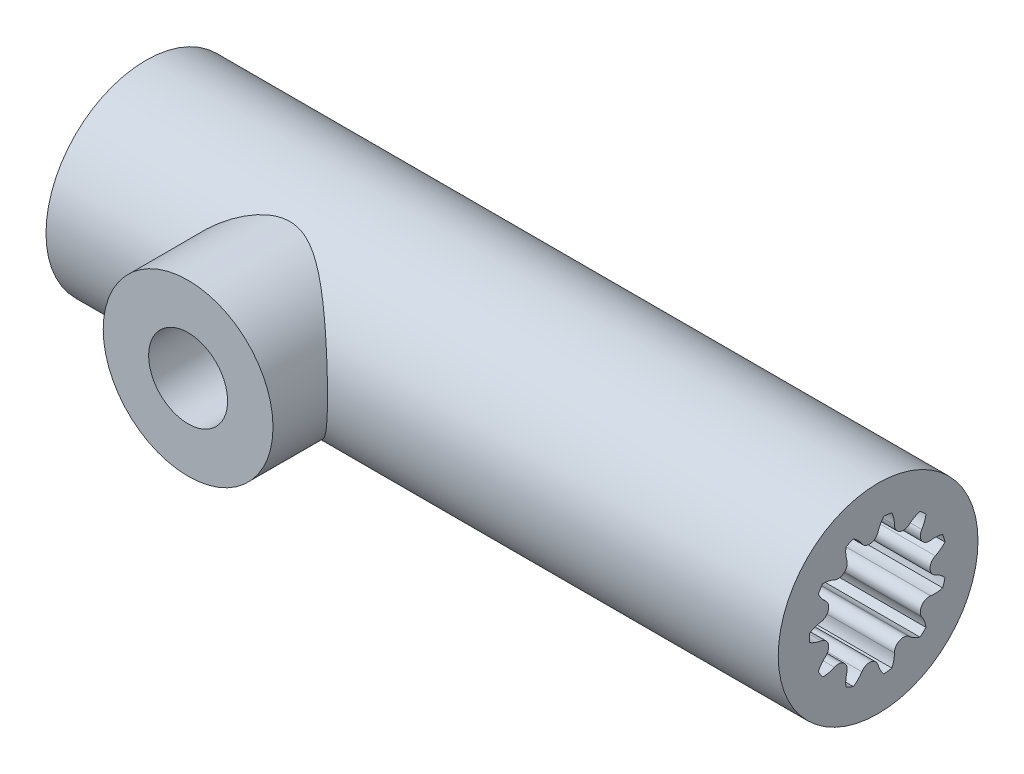
from build123d import *

# Parameters (mm, degrees)
SKETCH1_R           = 5.5
BOSS_EXTRUDE1_DEPTH = 14
SKETCH2_R           = 5.5
BOSS_EXTRUDE2_DEPTH = 13.52
SKETCH3_R           = 5.5
BOSS_EXTRUDE3_DEPTH = 12.8
SKETCH4_R           = 1.05
CUT_EXTRUDE1_DEPTH  = 3.5
SKETCH5_R           = 4.675
SKETCH5_R_2         = 2.175
BOSS_EXTRUDE4_DEPTH = 6
SKETCH5_2_R         = 2.175
CUT_EXTRUDE2_DEPTH  = 42.472308963


with BuildPart() as part:
    # Sketch1 → Boss-Extrude1 (new body)
    with BuildSketch(Plane.YZ):
        Circle(SKETCH1_R)
        with BuildLine():
            Line((-1.747140521, 2.5), (1.747140521, 2.5))
            ThreePointArc((1.747140521, 2.5), (0, -3.05), (-1.747140521, 2.5))
        make_face(mode=Mode.SUBTRACT)
    extrude(amount=BOSS_EXTRUDE1_DEPTH)

    # Sketch2 → Boss-Extrude2 (add)
    with BuildSketch(Plane.YZ.offset(14)):
        Circle(SKETCH2_R)
    extrude(amount=BOSS_EXTRUDE2_DEPTH)

    # Sketch3 → Boss-Extrude3 (add)
    with BuildSketch(Plane.YZ.offset(27.52)):
        Circle(SKETCH3_R)
        with BuildLine():
            ThreePointArc((-1.322019746, -2.893008891), (-1.318956528, -2.868853063), (-1.317084788, -2.844575833))
            ThreePointArc((-1.317084788, -2.844575833), (-1.543809469, -2.402214423), (-2.040380396, -2.37974197))
            ThreePointArc((-2.040380396, -2.37974197), (-2.061686193, -2.391529691), (-2.0823866, -2.404350785))
            ThreePointArc((-2.0823866, -2.404350785), (-2.380259348, -2.555545236), (-2.703854763, -2.638454478))
            ThreePointArc((-2.703854763, -2.638454478), (-2.855120731, -2.473976197), (-2.996397469, -2.300842198))
            ThreePointArc((-2.996397469, -2.300842198), (-2.868279694, -1.992339732), (-2.676232473, -1.719016114))
            ThreePointArc((-2.676232473, -1.719016114), (-2.660595904, -1.700351039), (-2.645896034, -1.680939672))
            ThreePointArc((-2.645896034, -1.680939672), (-2.597470339, -1.186224957), (-3.003062861, -0.898853414))
            ThreePointArc((-3.003062861, -0.898853414), (-3.02735936, -0.897251093), (-3.051705258, -0.896845399))
            ThreePointArc((-3.051705258, -0.896845399), (-3.384033651, -0.862996099), (-3.701083558, -0.757794901))
            ThreePointArc((-3.701083558, -0.757794901), (-3.739412915, -0.537646409), (-3.764659163, -0.315616851))
            ThreePointArc((-3.764659163, -0.315616851), (-3.490090608, -0.12535376), (-3.1807603, 0.000752133))
            ThreePointArc((-3.1807603, 0.000752133), (-3.157514879, 0.008000426), (-3.134653985, 0.016382957))
            ThreePointArc((-3.134653985, 0.016382957), (-2.82645273, 0.406382552), (-3.012294086, 0.86741475))
            ThreePointArc((-3.012294086, 0.86741475), (-3.031867321, 0.881898388), (-3.052129059, 0.895402065))
            ThreePointArc((-3.052129059, 0.895402065), (-3.31340118, 1.103548202), (-3.523244473, 1.363459202))
            ThreePointArc((-3.523244473, 1.363459202), (-3.43646792, 1.569382314), (-3.337668173, 1.769814617))
            ThreePointArc((-3.337668173, 1.769814617), (-3.003822413, 1.781431146), (-2.675419206, 1.720281583))
            ThreePointArc((-2.675419206, 1.720281583), (-2.65194519, 1.713811812), (-2.628181444, 1.708504114))
            ThreePointArc((-2.628181444, 1.708504114), (-2.158056349, 1.869966471), (-2.065143222, 2.35828486))
            ThreePointArc((-2.065143222, 2.35828486), (-2.07377883, 2.381051361), (-2.083523449, 2.4033657))
            ThreePointArc((-2.083523449, 2.4033657), (-2.190787246, 2.719723746), (-2.226800162, 3.051824643))
            ThreePointArc((-2.226800162, 3.051824643), (-2.042468641, 3.178143241), (-1.850991121, 3.293342448))
            ThreePointArc((-1.850991121, 3.293342448), (-1.563861826, 3.12262425), (-1.320651417, 2.893633786))
            ThreePointArc((-1.320651417, 2.893633786), (-1.304401641, 2.875500057), (-1.287279864, 2.858187286))
            ThreePointArc((-1.287279864, 2.858187286), (-0.804492326, 2.739849249), (-0.462323977, 3.100416189))
            ThreePointArc((-0.462323977, 3.100416189), (-0.457280213, 3.124237351), (-0.453413865, 3.148277707))
            ThreePointArc((-0.453413865, 3.148277707), (-0.372613841, 3.472406218), (-0.223362534, 3.771257322))
            ThreePointArc((-0.223362534, 3.771257322), (-0.111730141, 3.776213578), (0, 3.777866145))
            ThreePointArc((0, 3.777866145), (0.111730141, 3.776213578), (0.223362534, 3.771257322))
            ThreePointArc((0.223362534, 3.771257322), (0.372613841, 3.472406218), (0.453413865, 3.148277707))
            ThreePointArc((0.453413865, 3.148277707), (0.457280213, 3.124237351), (0.462323977, 3.100416189))
            ThreePointArc((0.462323977, 3.100416189), (0.804492326, 2.739849249), (1.287279864, 2.858187286))
            ThreePointArc((1.287279864, 2.858187286), (1.304401641, 2.875500057), (1.320651417, 2.893633786))
            ThreePointArc((1.320651417, 2.893633786), (1.563861826, 3.12262425), (1.850991121, 3.293342448))
            ThreePointArc((1.850991121, 3.293342448), (2.042468641, 3.178143241), (2.226800162, 3.051824643))
            ThreePointArc((2.226800162, 3.051824643), (2.190787246, 2.719723746), (2.083523449, 2.4033657))
            ThreePointArc((2.083523449, 2.4033657), (2.07377883, 2.381051361), (2.065143222, 2.35828486))
            ThreePointArc((2.065143222, 2.35828486), (2.158056349, 1.869966471), (2.628181444, 1.708504114))
            ThreePointArc((2.628181444, 1.708504114), (2.65194519, 1.713811812), (2.675419206, 1.720281583))
            ThreePointArc((2.675419206, 1.720281583), (3.003822413, 1.781431146), (3.337668173, 1.769814617))
            ThreePointArc((3.337668173, 1.769814617), (3.43646792, 1.569382314), (3.523244473, 1.363459202))
            ThreePointArc((3.523244473, 1.363459202), (3.31340118, 1.103548202), (3.052129059, 0.895402065))
            ThreePointArc((3.052129059, 0.895402065), (3.031867321, 0.881898388), (3.012294086, 0.86741475))
            ThreePointArc((3.012294086, 0.86741475), (2.82645273, 0.406382552), (3.134653985, 0.016382957))
            ThreePointArc((3.134653985, 0.016382957), (3.157514879, 0.008000426), (3.1807603, 0.000752133))
            ThreePointArc((3.1807603, 0.000752133), (3.490090608, -0.12535376), (3.764659163, -0.315616851))
            ThreePointArc((3.764659163, -0.315616851), (3.739412915, -0.537646409), (3.701083558, -0.757794901))
            ThreePointArc((3.701083558, -0.757794901), (3.384033651, -0.862996099), (3.051705258, -0.896845399))
            ThreePointArc((3.051705258, -0.896845399), (3.02735936, -0.897251093), (3.003062861, -0.898853414))
            ThreePointArc((3.003062861, -0.898853414), (2.597470339, -1.186224957), (2.645896034, -1.680939672))
            ThreePointArc((2.645896034, -1.680939672), (2.660595904, -1.700351039), (2.676232473, -1.719016114))
            ThreePointArc((2.676232473, -1.719016114), (2.868279694, -1.992339732), (2.996397469, -2.300842198))
            ThreePointArc((2.996397469, -2.300842198), (2.855120731, -2.473976197), (2.703854763, -2.638454478))
            ThreePointArc((2.703854763, -2.638454478), (2.380259349, -2.555545235), (2.082386604, -2.404350784))
            ThreePointArc((2.082386604, -2.404350784), (2.061686196, -2.39152969), (2.0403804, -2.379741969))
            ThreePointArc((2.0403804, -2.379741969), (1.54380947, -2.402214422), (1.317084788, -2.844575834))
            ThreePointArc((1.317084788, -2.844575834), (1.318956528, -2.868853064), (1.322019746, -2.893008892))
            ThreePointArc((1.322019746, -2.893008892), (1.335810244, -3.226771918), (1.27680075, -3.555566405))
            ThreePointArc((1.27680075, -3.555566405), (1.064347889, -3.624836022), (0.848171186, -3.6814234))
            ThreePointArc((0.848171186, -3.6814234), (0.62076952, -3.436726817), (0.45192491, -3.148491786))
            ThreePointArc((0.45192491, -3.148491786), (0.441442226, -3.12651451), (0.429891573, -3.105079266))
            ThreePointArc((0.429891573, -3.105079266), (0, -2.855517783), (-0.429891573, -3.105079265))
            ThreePointArc((-0.429891573, -3.105079265), (-0.441442226, -3.12651451), (-0.45192491, -3.148491786))
            ThreePointArc((-0.45192491, -3.148491786), (-0.62076952, -3.436726817), (-0.848171186, -3.6814234))
            ThreePointArc((-0.848171186, -3.6814234), (-1.064347889, -3.624836022), (-1.27680075, -3.555566405))
            ThreePointArc((-1.27680075, -3.555566405), (-1.335810244, -3.226771917), (-1.322019746, -2.893008891))
        make_face(mode=Mode.SUBTRACT)
    extrude(amount=BOSS_EXTRUDE3_DEPTH)

    # Sketch4 → Cut-Extrude1 (cut)
    with BuildSketch(Plane.YZ.offset(27.52)):
        Circle(SKETCH4_R)
    extrude(amount=-CUT_EXTRUDE1_DEPTH, mode=Mode.SUBTRACT)

    # Sketch5 → Boss-Extrude4 (add)
    with BuildSketch(Plane(origin=(0, 0, 2.5), x_dir=(-1, 0, 0), z_dir=(0, 0, -1))):
        with Locations((-10.825, 0)):
            Circle(SKETCH5_R)
        with Locations((-10.825, 0)):
            Circle(SKETCH5_R_2, mode=Mode.SUBTRACT)
    extrude(amount=-BOSS_EXTRUDE4_DEPTH)

    # Sketch5<2> → Cut-Extrude2 (cut, through all)
    with BuildSketch(Plane(origin=(0, 0, 2.5), x_dir=(-1, 0, 0), z_dir=(0, 0, -1))):
        with Locations((-10.825, 0)):
            Circle(SKETCH5_2_R)
    extrude(amount=-CUT_EXTRUDE2_DEPTH, mode=Mode.SUBTRACT)


solid = part.part
